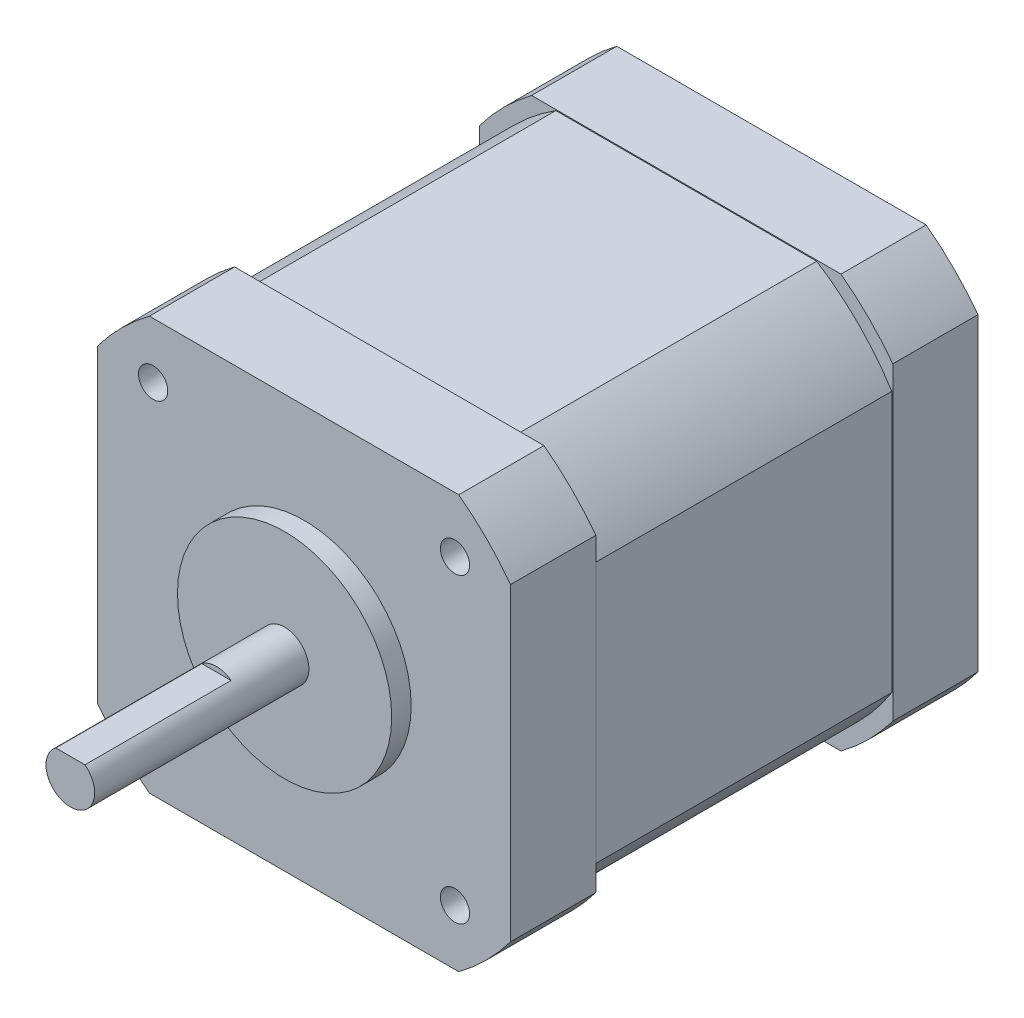
from build123d import *

# Parameters (mm, degrees)
SKETCH1_R                      = 2.5
BOSS_EXTRUDE1_DEPTH            = 24
SKETCH2_R                      = 11
BOSS_EXTRUDE2_DEPTH            = 2
SKETCH3_W                      = 42.418
SKETCH3_H                      = 42.418
BOSS_EXTRUDE3_DEPTH            = 48
CUT_EXTRUDE1_DEPTH             = 78.997713825
M3X0_5_TAPPED_HOLE1_AT_2_COUNT = 2
M3X0_5_TAPPED_HOLE1_AT_2_PITCH = 31
M3X0_5_TAPPED_HOLE1_AT_3_COUNT = 2
M3X0_5_TAPPED_HOLE1_AT_3_PITCH = 43.840620434
M3X0_5_TAPPED_HOLE1_AT_4_COUNT = 2
M3X0_5_TAPPED_HOLE1_AT_4_PITCH = 31
CUT_EXTRUDE2_START             = -15
CUT_EXTRUDE2_DEPTH             = 15
CUT_EXTRUDE3_DEPTH             = 15.25
CUT_EXTRUDE3_DEPTH_BACK        = 15.25


with BuildPart() as part:
    # Sketch1 → Boss-Extrude1 (new body)
    with BuildSketch(Plane.XY):
        Circle(SKETCH1_R)
    extrude(amount=BOSS_EXTRUDE1_DEPTH)

    # Sketch2 → Boss-Extrude2 (add)
    with BuildSketch(Plane(origin=(0, 0, 0), x_dir=(-1, 0, 0), z_dir=(0, 0, -1))):
        Circle(SKETCH2_R)
    extrude(amount=-BOSS_EXTRUDE2_DEPTH)

    # Sketch3 → Boss-Extrude3 (add)
    with BuildSketch(Plane(origin=(0, 0, 0), x_dir=(-1, 0, 0), z_dir=(0, 0, -1))):
        Rectangle(SKETCH3_W, SKETCH3_H)
    extrude(amount=BOSS_EXTRUDE3_DEPTH)

    # Sketch4 → Cut-Extrude1 (cut, through all)
    with BuildSketch(Plane(origin=(0, 0, -48), x_dir=(-1, 0, 0), z_dir=(0, 0, -1))):
        with BuildLine():
            Line((-21.209, -15.887992919), (-21.209, -21.209))
            Line((-21.209, -21.209), (-15.887992919, -21.209))
            ThreePointArc((-15.887992919, -21.209), (-18.738329701, -18.738329701), (-21.209, -15.887992919))
        make_face()
        with BuildLine():
            Line((15.887992919, -21.209), (21.209, -21.209))
            Line((21.209, -21.209), (21.209, -15.887992919))
            ThreePointArc((21.209, -15.887992919), (18.738329701, -18.738329701), (15.887992919, -21.209))
        make_face()
        with BuildLine():
            Line((21.209, 15.887992919), (21.209, 21.209))
            Line((21.209, 21.209), (15.887992919, 21.209))
            ThreePointArc((15.887992919, 21.209), (18.738329701, 18.738329701), (21.209, 15.887992919))
        make_face()
        with BuildLine():
            Line((-15.887992919, 21.209), (-21.209, 21.209))
            Line((-21.209, 21.209), (-21.209, 15.887992919))
            ThreePointArc((-21.209, 15.887992919), (-18.738329701, 18.738329701), (-15.887992919, 21.209))
        make_face()
    extrude(amount=-CUT_EXTRUDE1_DEPTH, mode=Mode.SUBTRACT)

    # Sketch5 → M3x0.5 Tapped Hole1 (revolve, cut)
    with BuildSketch(Plane(origin=(-15.5, 15.5, 0), x_dir=(0, -1, 0), z_dir=(1, 0, 0))):
        Polygon((0, 0), (0, 5.251075774), (1.25, 4.5), (1.25, 6), (1.5, 6), (1.5, 0), align=None)
    m3x0_5_tapped_hole1 = revolve(axis=Axis((-15.5, 15.5, 6.35), (0, 0, -1)), mode=Mode.SUBTRACT)

    # M3x0.5 Tapped Hole1 at 2: M3x0.5 Tapped Hole1 ×2
    with Locations(*[(0, -i * M3X0_5_TAPPED_HOLE1_AT_2_PITCH, 0) for i in range(1, M3X0_5_TAPPED_HOLE1_AT_2_COUNT)]):
        add(m3x0_5_tapped_hole1, mode=Mode.SUBTRACT)

    # M3x0.5 Tapped Hole1 at 3: M3x0.5 Tapped Hole1 ×2
    with Locations(*[Vector(0.7071067811865476, -0.7071067811865476, 0) * (i * M3X0_5_TAPPED_HOLE1_AT_3_PITCH) for i in range(1, M3X0_5_TAPPED_HOLE1_AT_3_COUNT)]):
        add(m3x0_5_tapped_hole1, mode=Mode.SUBTRACT)

    # M3x0.5 Tapped Hole1 at 4: M3x0.5 Tapped Hole1 ×2
    with Locations(*[(i * M3X0_5_TAPPED_HOLE1_AT_4_PITCH, 0, 0) for i in range(1, M3X0_5_TAPPED_HOLE1_AT_4_COUNT)]):
        add(m3x0_5_tapped_hole1, mode=Mode.SUBTRACT)

    # Sketch7 → Cut-Extrude2 (cut)
    with BuildSketch(Plane.XY.offset(24).offset(CUT_EXTRUDE2_START)):
        with BuildLine():
            Line((-1.5, 2), (1.5, 2))
            ThreePointArc((1.5, 2), (0, 2.5), (-1.5, 2))
        make_face()
    extrude(amount=CUT_EXTRUDE2_DEPTH, mode=Mode.SUBTRACT)

    # Sketch8 → Cut-Extrude3 (cut, two sides: drawn at the far end of the back side and taken through both)
    with BuildSketch(Plane.XY.offset(-24).offset(-CUT_EXTRUDE3_DEPTH_BACK)):
        with BuildLine():
            Line((15.887992919, 21.209), (-15.887992919, 21.209))
            ThreePointArc((-15.887992919, 21.209), (-18.738329701, 18.738329701), (-21.209, 15.887992919))
            Line((-21.209, 15.887992919), (-21.209, -15.887992919))
            ThreePointArc((-21.209, -15.887992919), (-18.738329701, -18.738329701), (-15.887992919, -21.209))
            Line((-15.887992919, -21.209), (15.887992919, -21.209))
            ThreePointArc((15.887992919, -21.209), (18.738329701, -18.738329701), (21.209, -15.887992919))
            Line((21.209, -15.887992919), (21.209, 15.887992919))
            ThreePointArc((21.209, 15.887992919), (18.738329701, 18.738329701), (15.887992919, 21.209))
        make_face()
        with BuildLine():
            Line((-13.394406258, 21.109), (13.394406258, 21.109))
            ThreePointArc((13.394406258, 21.109), (17.67766953, 17.67766953), (21.109, 13.394406258))
            Line((21.109, 13.394406258), (21.109, -13.394406258))
            ThreePointArc((21.109, -13.394406258), (17.67766953, -17.67766953), (13.394406258, -21.109))
            Line((13.394406258, -21.109), (-13.394406258, -21.109))
            ThreePointArc((-13.394406258, -21.109), (-17.67766953, -17.67766953), (-21.109, -13.394406258))
            Line((-21.109, -13.394406258), (-21.109, 13.394406258))
            ThreePointArc((-21.109, 13.394406258), (-17.67766953, 17.67766953), (-13.394406258, 21.109))
        make_face(mode=Mode.SUBTRACT)
    extrude(amount=CUT_EXTRUDE3_DEPTH + CUT_EXTRUDE3_DEPTH_BACK, mode=Mode.SUBTRACT)


solid = part.part
